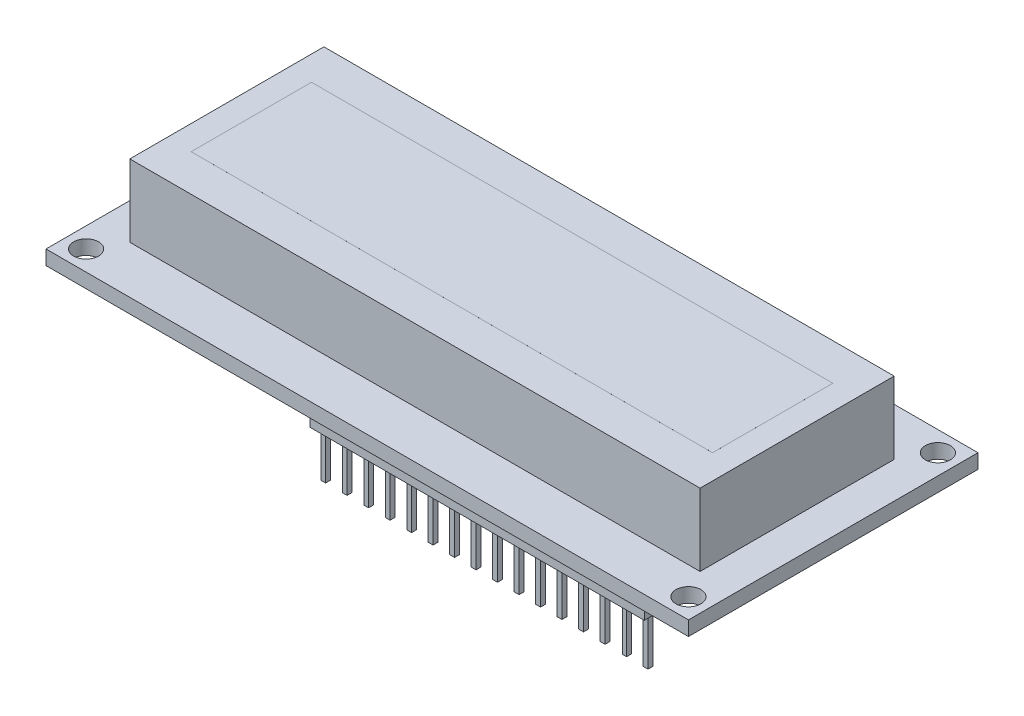
from build123d import *

# Parameters (mm, degrees)
SKETCH1_W                = 71.1
SKETCH1_H                = 24.2
BOSS_EXTRUDE1_DEPTH      = 6
SKETCH2_W                = 71.1
SKETCH2_H                = 24.2
SKETCH2_W_2              = 2.5
SKETCH2_H_2              = 18.2
BOSS_EXTRUDE2_DEPTH      = 3
SKETCH3_W                = 80.1
SKETCH3_H                = 36.1
SKETCH3_R                = 1.55
BOSS_EXTRUDE3_DEPTH      = 1.8
BOSS_EXTRUDE4_DEPTH      = 0.001
BOSS_EXTRUDE4_DEPTH_BACK = 6
SKETCH4_W                = 65
SKETCH4_H                = 15
SKETCH5_W                = 41.7
SKETCH5_H                = 2.5
BOSS_EXTRUDE5_DEPTH      = 2.5
SKETCH6_W                = 0.6
SKETCH6_H                = 0.6
SKETCH6_W_2              = 0.52
BOSS_EXTRUDE6_DEPTH      = 6


with BuildPart() as part:
    # Sketch1 → Boss-Extrude1 (new body)
    with BuildSketch(Plane(origin=(0, 0, 0), x_dir=(1, 0, 0), z_dir=(0, 1, 0))):
        Rectangle(SKETCH1_W, SKETCH1_H)
    extrude(amount=BOSS_EXTRUDE1_DEPTH)

    # Sketch2 → Boss-Extrude2 (add)
    with BuildSketch(Plane.XZ):
        Rectangle(SKETCH2_W, SKETCH2_H)
        with Locations((-36.8, 0)):
            Rectangle(SKETCH2_W_2, SKETCH2_H_2)
    extrude(amount=BOSS_EXTRUDE2_DEPTH)

    # Sketch3 → Boss-Extrude3 (add)
    with BuildSketch(Plane.XZ.offset(3)):
        Rectangle(SKETCH3_W, SKETCH3_H)
        with Locations(Location((-37.55, -15.55, 0), (0, 0, 270))):
            Circle(SKETCH3_R, mode=Mode.SUBTRACT)
        with Locations(Location((37.55, -15.55, 0), (0, 0, 90))):
            Circle(SKETCH3_R, mode=Mode.SUBTRACT)
        with Locations(Location((37.55, 15.55, 0), (0, 0, 270))):
            Circle(SKETCH3_R, mode=Mode.SUBTRACT)
        with Locations(Location((-37.55, 15.55, 0), (0, 0, 90))):
            Circle(SKETCH3_R, mode=Mode.SUBTRACT)
    extrude(amount=BOSS_EXTRUDE3_DEPTH)

    # Sketch4 → Boss-Extrude4 (add, two sides: drawn at the far end of the back side and taken through both)
    with BuildSketch(Plane(origin=(0, 6, 0), x_dir=(1, 0, 0), z_dir=(0, 1, 0)).offset(-BOSS_EXTRUDE4_DEPTH_BACK)):
        Rectangle(SKETCH4_W, SKETCH4_H)
    extrude(amount=BOSS_EXTRUDE4_DEPTH + BOSS_EXTRUDE4_DEPTH_BACK)

    # Sketch5 → Boss-Extrude5 (add)
    with BuildSketch(Plane.XZ.offset(4.8)):
        with Locations((12.2, 15.3)):
            Rectangle(SKETCH5_W, SKETCH5_H)
    extrude(amount=BOSS_EXTRUDE5_DEPTH)

    # Sketch6 → Boss-Extrude6 (add)
    with BuildSketch(Plane.XZ.offset(7.3)):
        with Locations((32.25, 15.292216916)):
            Rectangle(SKETCH6_W, SKETCH6_H)
        with Locations((29.61, 15.292216916)):
            Rectangle(SKETCH6_W_2, SKETCH6_H)
        with Locations((26.89, 15.292216916)):
            Rectangle(SKETCH6_W, SKETCH6_H)
        with Locations((24.21, 15.292216916)):
            Rectangle(SKETCH6_W, SKETCH6_H)
        with Locations((21.53, 15.292216916)):
            Rectangle(SKETCH6_W, SKETCH6_H)
        with Locations((18.85, 15.292216916)):
            Rectangle(SKETCH6_W, SKETCH6_H)
        with Locations((16.17, 15.292216916)):
            Rectangle(SKETCH6_W, SKETCH6_H)
        with Locations((13.49, 15.292216916)):
            Rectangle(SKETCH6_W, SKETCH6_H)
        with Locations((10.81, 15.292216916)):
            Rectangle(SKETCH6_W, SKETCH6_H)
        with Locations((8.13, 15.292216916)):
            Rectangle(SKETCH6_W, SKETCH6_H)
        with Locations((5.45, 15.292216916)):
            Rectangle(SKETCH6_W, SKETCH6_H)
        with Locations((2.77, 15.292216916)):
            Rectangle(SKETCH6_W, SKETCH6_H)
        with Locations((-7.95, 15.292216916)):
            Rectangle(SKETCH6_W, SKETCH6_H)
        with Locations((-5.27, 15.292216916)):
            Rectangle(SKETCH6_W, SKETCH6_H)
        with Locations((0.09, 15.292216916)):
            Rectangle(SKETCH6_W, SKETCH6_H)
        with Locations((-2.59, 15.292216916)):
            Rectangle(SKETCH6_W, SKETCH6_H)
    extrude(amount=BOSS_EXTRUDE6_DEPTH)


solid = part.part
